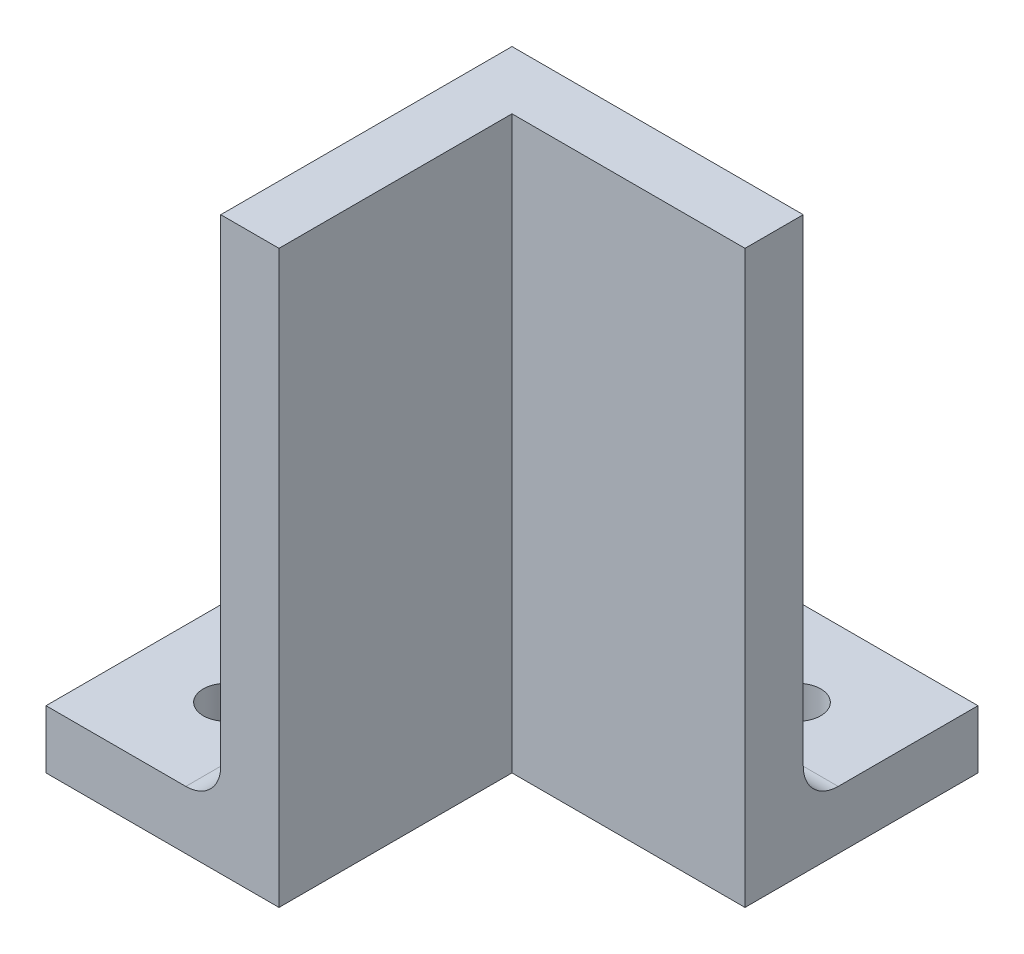
from build123d import *

# Parameters (mm, degrees)
BOSS_EXTRUDE1_DEPTH = 5
SKETCH2_W           = 5
SKETCH2_H           = 20
SKETCH2_H_2         = 5
SKETCH2_W_2         = 20
BOSS_EXTRUDE2_DEPTH = 44
SKETCH3_R           = 2
CUT_EXTRUDE1_DEPTH  = 53.306787322
FILLET1_R           = 3
FILLET2_R           = 3


with BuildPart() as part:
    # Sketch1 → Boss-Extrude1 (new body)
    with BuildSketch(Plane(origin=(0, 0, 0), x_dir=(1, 0, 0), z_dir=(0, 1, 0))):
        Polygon((20, 20), (-20, 20), (-20, -20), (0, -20), (0, 0), (20, 0), align=None)
    extrude(amount=BOSS_EXTRUDE1_DEPTH)

    # Sketch2 → Boss-Extrude2 (add)
    with BuildSketch(Plane(origin=(0, 5, 0), x_dir=(1, 0, 0), z_dir=(0, 1, 0))):
        with Locations((-2.5, -10)):
            Rectangle(SKETCH2_W, SKETCH2_H)
        with Locations((-2.5, 2.5)):
            Rectangle(SKETCH2_W, SKETCH2_H_2)
        with Locations((10, 2.5)):
            Rectangle(SKETCH2_W_2, SKETCH2_H_2)
    extrude(amount=BOSS_EXTRUDE2_DEPTH)

    # Sketch3 → Cut-Extrude1 (cut, through all)
    with BuildSketch(Plane(origin=(0, 5, 0), x_dir=(1, 0, 0), z_dir=(0, 1, 0))):
        with Locations(Location((-12.5, -12, 0), (0, 0, 270))):
            Circle(SKETCH3_R)
        with Locations(Location((-12.5, 12.5, 0), (0, 0, 270))):
            Circle(SKETCH3_R)
        with Locations(Location((12, 12.5, 0), (0, 0, 270))):
            Circle(SKETCH3_R)
        with Locations(Location((-12.5, 0, 0), (0, 0, 270))):
            Circle(SKETCH3_R)
        with Locations(Location((0, 12.5, 0), (0, 0, 270))):
            Circle(SKETCH3_R)
    extrude(amount=-CUT_EXTRUDE1_DEPTH, mode=Mode.SUBTRACT)

    # Fillet1
    fillet1_edges = [part.edges().sort_by_distance(p)[0] for p in [
        (7.5, 5, -5),
        (-5, 5, 7.5),
    ]]
    fillet(fillet1_edges, radius=FILLET1_R)

    # Fillet2
    fillet2_edges = [part.edges().sort_by_distance(p)[0] for p in [
        (-20, 2.5, -20),
    ]]
    fillet(fillet2_edges, radius=FILLET2_R)


solid = part.part
